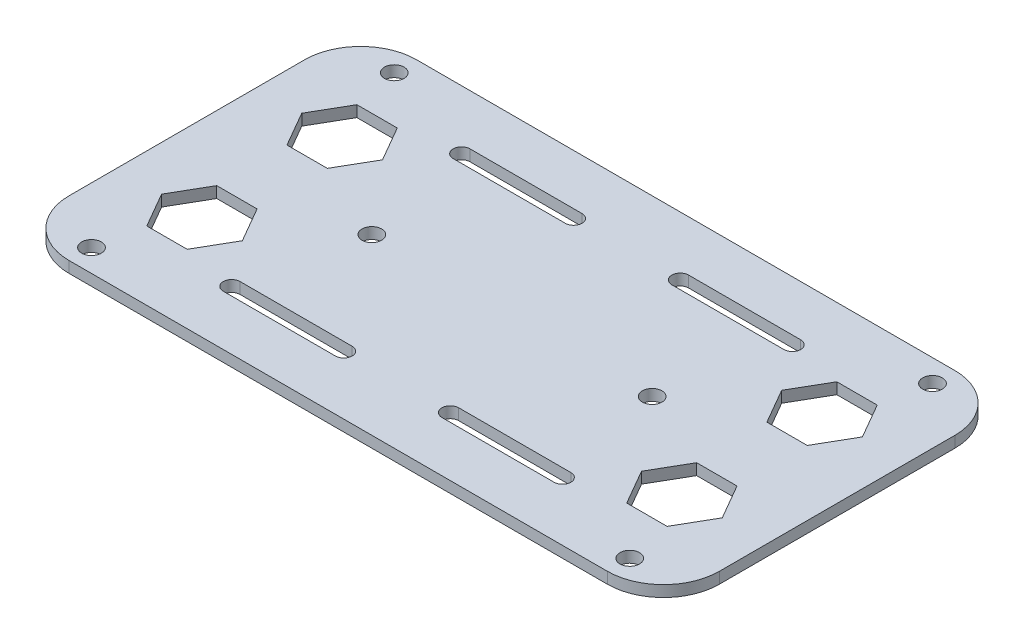
from build123d import *

# Parameters (mm, degrees)
SKETCH1_W           = 116
SKETCH1_H           = 62
BOSS_EXTRUDE1_DEPTH = 2
SKETCH2_R           = 1.75
CUT_EXTRUDE1_DEPTH  = 2
SKETCH3_R           = 1.75
CUT_EXTRUDE2_DEPTH  = 2
FILLET2_R           = 10


with BuildPart() as part:
    # Sketch1 → Boss-Extrude1 (new body)
    with BuildSketch(Plane(origin=(0, 0, 0), x_dir=(1, 0, 0), z_dir=(0, 1, 0))):
        Rectangle(SKETCH1_W, SKETCH1_H)
    extrude(amount=BOSS_EXTRUDE1_DEPTH)

    # Sketch2 → Cut-Extrude1 (cut)
    with BuildSketch(Plane(origin=(0, 2, 0), x_dir=(1, 0, 0), z_dir=(0, 1, 0))):
        with Locations(Location((-48, 27, 0), (0, 0, 270))):
            Circle(SKETCH2_R)
        with Locations(Location((48, 27, 0), (0, 0, 270))):
            Circle(SKETCH2_R)
        with Locations(Location((48, -27, 0), (0, 0, 270))):
            Circle(SKETCH2_R)
        with Locations(Location((-48, -27, 0), (0, 0, 270))):
            Circle(SKETCH2_R)
    extrude(amount=-CUT_EXTRUDE1_DEPTH, mode=Mode.SUBTRACT)

    # Sketch3 → Cut-Extrude2 (cut)
    with BuildSketch(Plane(origin=(0, 2, 0), x_dir=(1, 0, 0), z_dir=(0, 1, 0))):
        with Locations(Location((25, 0, 0), (0, 0, 270))):
            Circle(SKETCH3_R)
        with Locations(Location((-25, 0, 0), (0, 0, 270))):
            Circle(SKETCH3_R)
        with BuildLine():
            Line((9.5, -19), (29.5, -19))
            ThreePointArc((29.5, -19), (31, -20.5), (29.5, -22))
            Line((29.5, -22), (9.5, -22))
            ThreePointArc((9.5, -22), (8, -20.5), (9.5, -19))
        make_face()
        with BuildLine():
            Line((-9.5, -22), (-29.5, -22))
            ThreePointArc((-29.5, -22), (-31, -20.5), (-29.5, -19))
            Line((-29.5, -19), (-9.5, -19))
            ThreePointArc((-9.5, -19), (-8, -20.5), (-9.5, -22))
        make_face()
        with BuildLine():
            Line((-29.5, 22), (-9.5, 22))
            ThreePointArc((-9.5, 22), (-8, 20.5), (-9.5, 19))
            Line((-9.5, 19), (-29.5, 19))
            ThreePointArc((-29.5, 19), (-31, 20.5), (-29.5, 22))
        make_face()
        with BuildLine():
            Line((9.5, 22), (29.5, 22))
            ThreePointArc((29.5, 22), (31, 20.5), (29.5, 19))
            Line((29.5, 19), (9.5, 19))
            ThreePointArc((9.5, 19), (8, 20.5), (9.5, 22))
        make_face()
        Polygon((-35.6, 12.5), (-39.2, 18.735382907), (-46.4, 18.735382907), (-50, 12.5), (-46.4, 6.264617093), (-39.2, 6.264617093), align=None)
        Polygon((-35.6, -12.5), (-39.2, -6.264617093), (-46.4, -6.264617093), (-50, -12.5), (-46.4, -18.735382907), (-39.2, -18.735382907), align=None)
        Polygon((50, 12.5), (46.4, 18.735382907), (39.2, 18.735382907), (35.6, 12.5), (39.2, 6.264617093), (46.4, 6.264617093), align=None)
        Polygon((50, -12.5), (46.4, -6.264617093), (39.2, -6.264617093), (35.6, -12.5), (39.2, -18.735382907), (46.4, -18.735382907), align=None)
    extrude(amount=-CUT_EXTRUDE2_DEPTH, mode=Mode.SUBTRACT)

    # Fillet2
    fillet2_edges = [part.edges().sort_by_distance(p)[0] for p in [
        (58, 1, 31),
        (-58, 1, 31),
        (-58, 1, -31),
        (58, 1, -31),
    ]]
    fillet(fillet2_edges, radius=FILLET2_R)


solid = part.part
